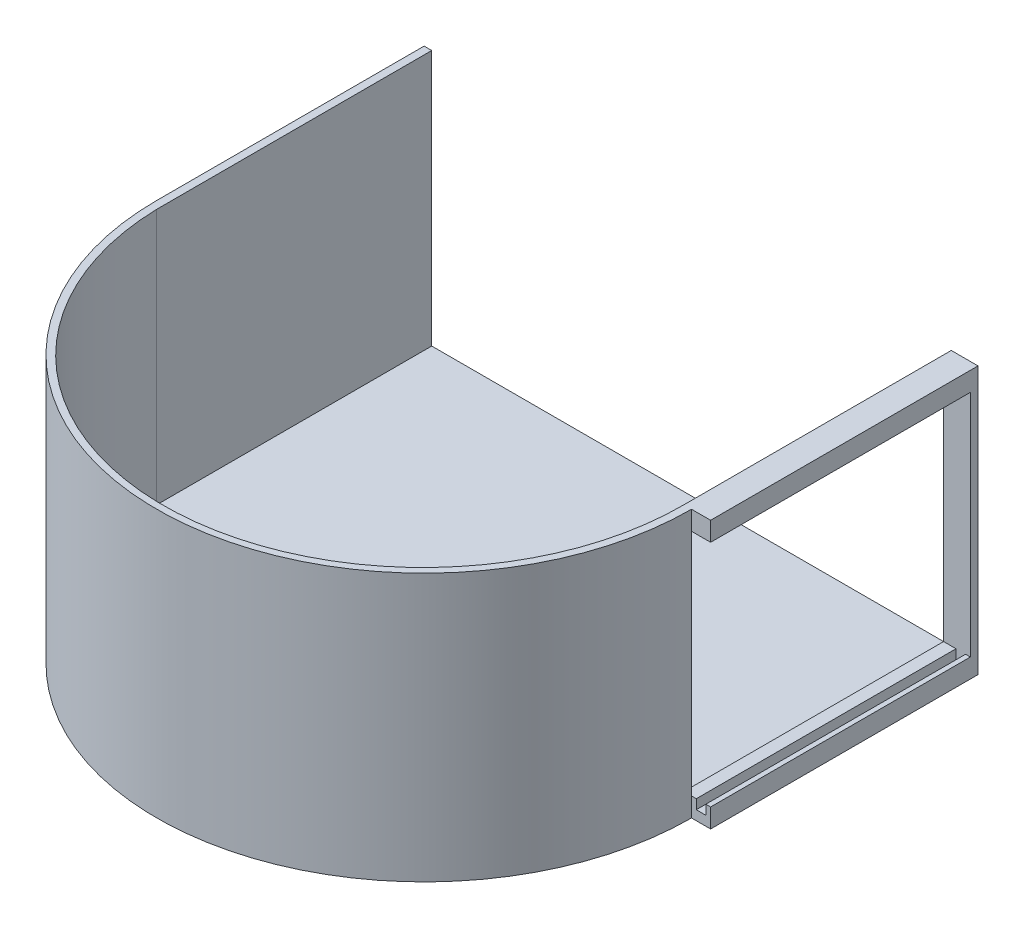
from build123d import *

# Parameters (mm, degrees)
BOSS_EXTRUDE1_DEPTH = 88.9
CUT_EXTRUDE1_DEPTH  = 85.09
BOSS_EXTRUDE3_DEPTH = 6.35
SKETCH6_W           = 3.175
SKETCH6_H           = 86.36
CUT_EXTRUDE2_DEPTH  = 3.175
SKETCH7_W           = 86.36
SKETCH7_H           = 76.2
CUT_EXTRUDE3_DEPTH  = 2.54


with BuildPart() as part:
    # Sketch1 → Boss-Extrude1 (new body)
    with BuildSketch(Plane(origin=(0, 0, 0), x_dir=(1, 0, 0), z_dir=(0, 1, 0))):
        with BuildLine():
            Line((0, 0), (0, 88.9))
            Line((0, 88.9), (177.8, 88.9))
            Line((177.8, 88.9), (177.8, 0))
            ThreePointArc((177.8, 0), (88.9, -88.9), (0, 0))
        make_face()
    extrude(amount=BOSS_EXTRUDE1_DEPTH)

    # Sketch2 → Cut-Extrude1 (cut)
    with BuildSketch(Plane(origin=(0, 88.9, 0), x_dir=(1, 0, 0), z_dir=(0, 1, 0))):
        with BuildLine():
            Line((2.54, 88.9), (175.26, 88.9))
            Line((175.26, 88.9), (175.26, 0))
            ThreePointArc((175.26, 0), (90.15621165, -86.692392179), (2.54, -2.54))
            Line((2.54, -2.54), (2.54, 88.9))
        make_face()
    extrude(amount=-CUT_EXTRUDE1_DEPTH, mode=Mode.SUBTRACT)

    # Sketch4 → Boss-Extrude3 (add)
    with BuildSketch(Plane(origin=(177.8, 0, 0), x_dir=(0, 0, -1), z_dir=(1, 0, 0))):
        Polygon((0, 88.9), (88.9, 88.9), (88.9, 0), (0, 0), (0, 6.35), (86.36, 6.35), (86.36, 82.55), (0, 82.55), align=None)
    extrude(amount=BOSS_EXTRUDE3_DEPTH)

    # Sketch6 → Cut-Extrude2 (cut)
    with BuildSketch(Plane(origin=(0, 6.35, 0), x_dir=(1, 0, 0), z_dir=(0, 1, 0))):
        with Locations((180.975, 43.18)):
            Rectangle(SKETCH6_W, SKETCH6_H)
    extrude(amount=-CUT_EXTRUDE2_DEPTH, mode=Mode.SUBTRACT)

    # Sketch7 → Cut-Extrude3 (cut)
    with BuildSketch(Plane(origin=(177.8, 0, 0), x_dir=(0, 0, -1), z_dir=(1, 0, 0))):
        with Locations((43.18, 44.45)):
            Rectangle(SKETCH7_W, SKETCH7_H)
    extrude(amount=-CUT_EXTRUDE3_DEPTH, mode=Mode.SUBTRACT)


solid = part.part
